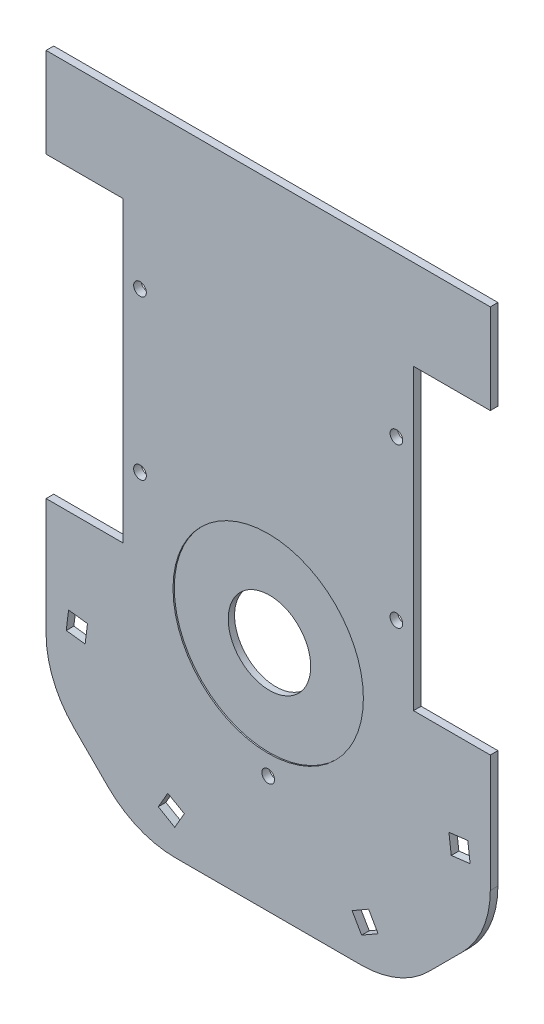
from build123d import *

# Parameters (mm, degrees)
SKETCH_1_W          = 100
SKETCH_1_H          = 70
SKETCH_1_R          = 1
SKETCH_1_R_2        = 6.5
EXTRUDE_2_DEPTH     = 1.2
SKETCH_2_W          = 47
SKETCH_2_H          = 12.1
CUT_EXTRUDE_1_DEPTH = 106.954896064
SKETCH_4_R          = 15
CUT_EXTRUDE_2_DEPTH = 0.2
CUT_EXTRUDE_4_DEPTH = 106.954896064
FILLET_3_R          = 15
CUT_EXTRUDE_6_DEPTH = 106.954896064


with BuildPart() as part:
    # ｽｹｯﾁ1 → ﾎﾞｽ - 押し出し2 (new body)
    with BuildSketch(Plane(origin=(0, 0, 0), x_dir=(0, 1, 0), z_dir=(0, 0, 1))):
        with Locations((-50, 0)):
            Rectangle(SKETCH_1_W, SKETCH_1_H)
        with Locations(Location((-25.147606065, 20.2, 0), (0, 0, 270))):
            Circle(SKETCH_1_R, mode=Mode.SUBTRACT)
        with Locations(Location((-50.167606065, 20.2, 0), (0, 0, 270))):
            Circle(SKETCH_1_R, mode=Mode.SUBTRACT)
        with Locations(Location((-25.147606065, -20.2, 0), (0, 0, 270))):
            Circle(SKETCH_1_R, mode=Mode.SUBTRACT)
        with Locations(Location((-50.167606065, -20.2, 0), (0, 0, 270))):
            Circle(SKETCH_1_R, mode=Mode.SUBTRACT)
        with Locations(Location((-63.441664971, 0, 0), (0, 0, 270))):
            Circle(SKETCH_1_R_2, mode=Mode.SUBTRACT)
        with Locations(Location((-81.5344254, 0, 0), (0, 0, 270))):
            Circle(SKETCH_1_R, mode=Mode.SUBTRACT)
    extrude(amount=-EXTRUDE_2_DEPTH)

    # ｽｹｯﾁ2 → ｶｯﾄ - 押し出し1 (cut, through all)
    with BuildSketch(Plane(origin=(0, 0, 0), x_dir=(0, 1, 0), z_dir=(0, 0, 1))):
        with Locations((-37.657606065, 28.95)):
            Rectangle(SKETCH_2_W, SKETCH_2_H)
        with Locations((-37.657606065, -28.95)):
            Rectangle(SKETCH_2_W, SKETCH_2_H)
    extrude(amount=-CUT_EXTRUDE_1_DEPTH, mode=Mode.SUBTRACT)

    # ｽｹｯﾁ4 → ｶｯﾄ - 押し出し2 (cut)
    with BuildSketch(Plane.XY):
        with Locations((0, -63.441664971)):
            Circle(SKETCH_4_R)
    extrude(amount=-CUT_EXTRUDE_2_DEPTH, mode=Mode.SUBTRACT)

    # ｽｹｯﾁ7 → ｶｯﾄ - 押し出し4 (cut, through all)
    with BuildSketch(Plane.XY):
        Polygon((-35, -85.857864376), (-20.857864376, -100), (-35, -100), align=None)
        Polygon((35, -85.857864376), (35, -100), (20.857864376, -100), align=None)
    extrude(amount=-CUT_EXTRUDE_4_DEPTH, mode=Mode.SUBTRACT)

    # ﾌｨﾚｯﾄ3
    fillet_3_edges = [part.edges().sort_by_distance(p)[0] for p in [
        (-35, -85.857864376, -0.6),
        (-20.857864376, -100, -0.6),
        (20.857864376, -100, -0.6),
        (35, -85.857864376, -0.6),
    ]]
    fillet(fillet_3_edges, radius=FILLET_3_R)

    # ｽｹｯﾁ11 → ｶｯﾄ - 押し出し6 (cut, through all)
    with BuildSketch(Plane.XY):
        Polygon((31.822624011, -77.576242792), (28.844985556, -77.941850822), (28.479377526, -74.964212367), (31.45701598, -74.598604337), align=None)
        Polygon((15.82016764, -91.78479944), (13.222091429, -93.28479944), (14.722091429, -95.882875652), (17.32016764, -94.382875652), align=None)
        Polygon((-31.45701598, -74.598604337), (-28.479377526, -74.964212367), (-28.844985556, -77.941850822), (-31.822624011, -77.576242792), align=None)
        Polygon((-14.722091429, -95.882875652), (-17.32016764, -94.382875652), (-15.82016764, -91.78479944), (-13.222091429, -93.28479944), align=None)
    extrude(amount=-CUT_EXTRUDE_6_DEPTH, mode=Mode.SUBTRACT)


solid = part.part
